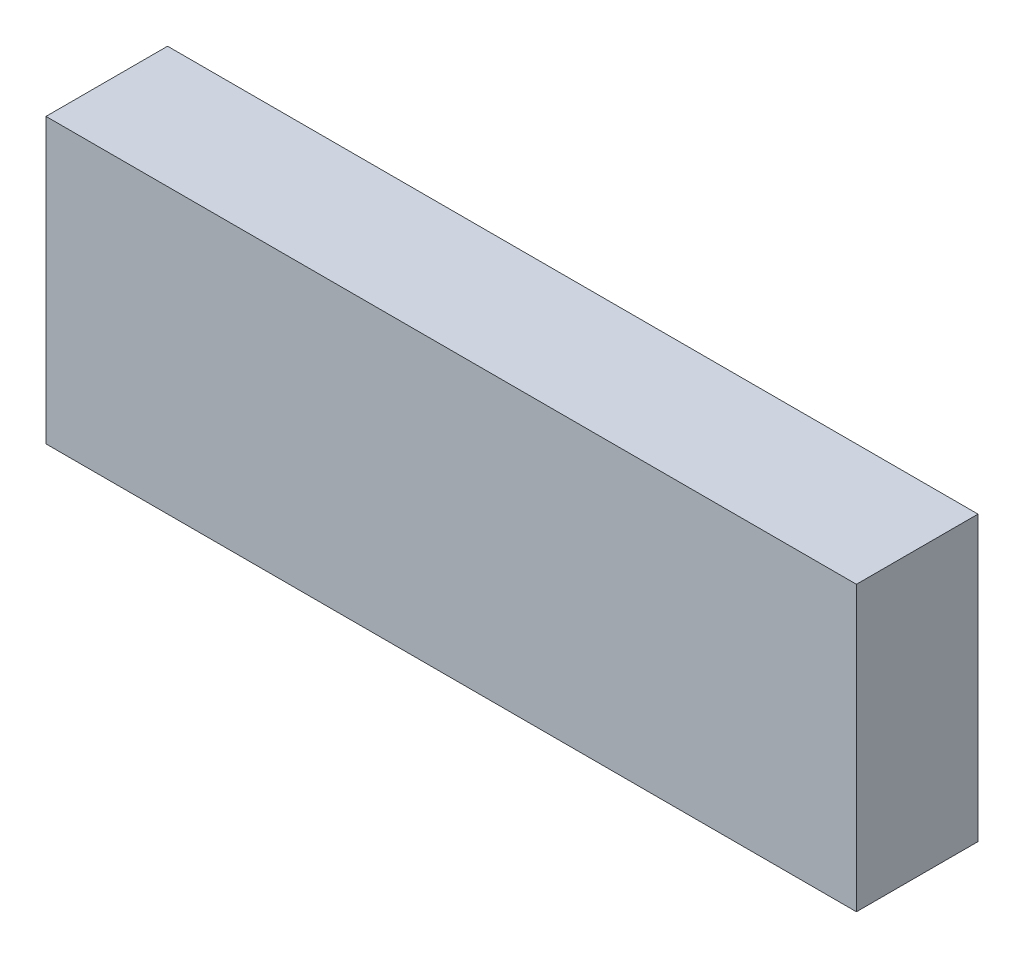
from build123d import *

# Parameters (mm, degrees)
SKETCH1_W           = 254
SKETCH1_H           = 88.9
BOSS_EXTRUDE1_DEPTH = 38.1


with BuildPart() as part:
    # Sketch1 → Boss-Extrude1 (new body)
    with BuildSketch(Plane.XY):
        with Locations((127, 44.45)):
            Rectangle(SKETCH1_W, SKETCH1_H)
    extrude(amount=BOSS_EXTRUDE1_DEPTH)


solid = part.part
